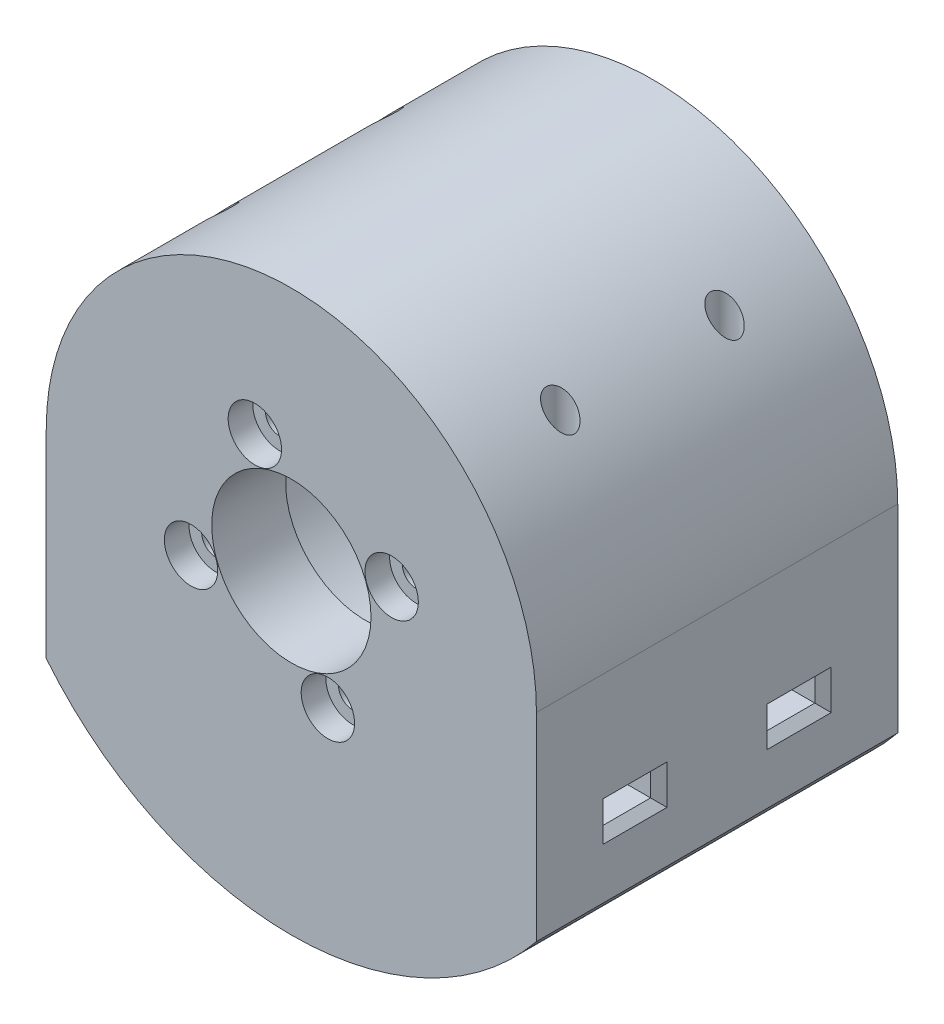
from build123d import *
from build123d.topology import SkipClean

# Parameters (mm, degrees)
BOSS_EXTRUDE1_DEPTH            = 44
CUT_EXTRUDE1_DEPTH             = 35
CUT_EXTRUDE2_REACH             = 67.586
SKETCH2_R                      = 9.7
CBORE_FOR_M3_SHCS1_D           = 3.4
CBORE_FOR_M3_SHCS1_CBORE_D     = 6.5
CBORE_FOR_M3_SHCS1_CBORE_DEPTH = 3
CUT_EXTRUDE3_REACH             = 82.169
SKETCH6_R                      = 1.7
CUT_EXTRUDE4_DEPTH             = 2.8
CHAMFER1_SIZE                  = 1
SPLIT1_SURFACE_1_BACK          = 92.883
SPLIT1_SURFACE_1_DEPTH         = 185.766
SPLIT1_SURFACE_2_BACK          = 92.883
SPLIT1_SURFACE_2_DEPTH         = 185.766
BOSS_EXTRUDE2_START            = -44
BOSS_EXTRUDE2_DEPTH            = 44
SKETCH10_R                     = 1.7
CUT_EXTRUDE5_DEPTH             = 65.916094004
CUT_EXTRUDE6_DEPTH             = 73.576735423
BOSS_EXTRUDE3_DEPTH            = 44


with BuildPart() as part:
    # Sketch1 → Boss-Extrude1 (new body)
    with BuildSketch(Plane.XY):
        with BuildLine():
            Line((-9.452299133, -24.156520859), (-29.85, -24.156520859))
            ThreePointArc((-29.85, -24.156520859), (0, -38.4), (29.85, -24.156520859))
            Line((29.85, -24.156520859), (9.452299133, -24.156520859))
            ThreePointArc((9.452299133, -24.156520859), (0, -27.2), (-9.452299133, -24.156520859))
        make_face()
        with BuildLine():
            Line((29.85, 15.843479141), (-29.85, 15.843479141))
            Line((-29.85, 15.843479141), (-29.85, -24.156520859))
            Line((-29.85, -24.156520859), (-9.452299133, -24.156520859))
            ThreePointArc((-9.452299133, -24.156520859), (-7.392995132, 3.414701626), (16.2, -11))
            ThreePointArc((16.2, -11), (14.414701626, -18.392995132), (9.452299133, -24.156520859))
            Line((9.452299133, -24.156520859), (29.85, -24.156520859))
            Line((29.85, -24.156520859), (29.85, 15.843479141))
        make_face()
        with BuildLine():
            ThreePointArc((16.2, -11), (-7.392995132, 3.414701626), (-9.452299133, -24.156520859))
            Line((-9.452299133, -24.156520859), (9.452299133, -24.156520859))
            ThreePointArc((9.452299133, -24.156520859), (14.414701626, -18.392995132), (16.2, -11))
        make_face()
        with BuildLine():
            Line((9.452299133, -24.156520859), (-9.452299133, -24.156520859))
            ThreePointArc((-9.452299133, -24.156520859), (0, -27.2), (9.452299133, -24.156520859))
        make_face()
    extrude(amount=BOSS_EXTRUDE1_DEPTH)

    # Sketch1<3> → Cut-Extrude1 (cut)
    with BuildSketch(Plane.XY):
        with BuildLine():
            ThreePointArc((16.2, -11), (-7.392995132, 3.414701626), (-9.452299133, -24.156520859))
            Line((-9.452299133, -24.156520859), (9.452299133, -24.156520859))
            ThreePointArc((9.452299133, -24.156520859), (14.414701626, -18.392995132), (16.2, -11))
        make_face()
        with BuildLine():
            Line((9.452299133, -24.156520859), (-9.452299133, -24.156520859))
            ThreePointArc((-9.452299133, -24.156520859), (0, -27.2), (9.452299133, -24.156520859))
        make_face()
    extrude(amount=CUT_EXTRUDE1_DEPTH, mode=Mode.SUBTRACT)

    # Sketch2 → Cut-Extrude2 (cut, up to next)
    with BuildSketch(Plane.XY.offset(44), mode=Mode.PRIVATE) as cut_extrude2_sk1:
        with Locations((0, -11)):
            Circle(SKETCH2_R)
    cut_extrude2_tool1 = extrude(cut_extrude2_sk1.sketch, amount=-CUT_EXTRUDE2_REACH, mode=Mode.PRIVATE) & part.part
    add(cut_extrude2_tool1.solids().sort_by_distance((0, -11, 44))[0], mode=Mode.SUBTRACT)

    # CBORE for M3 SHCS1 (through all)
    with Locations(Plane.XY.offset(44)):
        with Locations((-12.21600407, -15.446261863), (12.21600407, -6.553738137), (4.446261863, -23.21600407), (-4.446261863, 1.21600407)):
            CounterBoreHole(CBORE_FOR_M3_SHCS1_D / 2, CBORE_FOR_M3_SHCS1_CBORE_D / 2, CBORE_FOR_M3_SHCS1_CBORE_DEPTH)

    # Sketch6 → Cut-Extrude3 (cut, up to next)
    with BuildSketch(Plane(origin=(0, -44.156520859, 0), x_dir=(-1, 0, 0), z_dir=(0, -1, 0)), mode=Mode.PRIVATE) as cut_extrude3_sk1:
        with Locations(Location((20.75, -12, 0), (0, 0, 180))):
            Circle(SKETCH6_R)
    cut_extrude3_tool1 = extrude(cut_extrude3_sk1.sketch, amount=-CUT_EXTRUDE3_REACH, mode=Mode.PRIVATE) & part.part
    # Sketch6 → Cut-Extrude3 (cut, up to next)
    with BuildSketch(Plane(origin=(0, -44.156520859, 0), x_dir=(-1, 0, 0), z_dir=(0, -1, 0)), mode=Mode.PRIVATE) as cut_extrude3_sk2:
        with Locations(Location((-20.75, -12, 0), (0, 0, 180))):
            Circle(SKETCH6_R)
    cut_extrude3_tool2 = extrude(cut_extrude3_sk2.sketch, amount=-CUT_EXTRUDE3_REACH, mode=Mode.PRIVATE) & part.part
    # Sketch6 → Cut-Extrude3 (cut, up to next)
    with BuildSketch(Plane(origin=(0, -44.156520859, 0), x_dir=(-1, 0, 0), z_dir=(0, -1, 0)), mode=Mode.PRIVATE) as cut_extrude3_sk3:
        with Locations(Location((20.75, -32, 0), (0, 0, 180))):
            Circle(SKETCH6_R)
    cut_extrude3_tool3 = extrude(cut_extrude3_sk3.sketch, amount=-CUT_EXTRUDE3_REACH, mode=Mode.PRIVATE) & part.part
    # Sketch6 → Cut-Extrude3 (cut, up to next)
    with BuildSketch(Plane(origin=(0, -44.156520859, 0), x_dir=(-1, 0, 0), z_dir=(0, -1, 0)), mode=Mode.PRIVATE) as cut_extrude3_sk4:
        with Locations(Location((-20.75, -32, 0), (0, 0, 180))):
            Circle(SKETCH6_R)
    cut_extrude3_tool4 = extrude(cut_extrude3_sk4.sketch, amount=-CUT_EXTRUDE3_REACH, mode=Mode.PRIVATE) & part.part
    add(cut_extrude3_tool1.solids().sort_by_distance((-20.75, -44.156521, 12))[0], mode=Mode.SUBTRACT)
    add(cut_extrude3_tool2.solids().sort_by_distance((20.75, -44.156521, 12))[0], mode=Mode.SUBTRACT)
    add(cut_extrude3_tool3.solids().sort_by_distance((-20.75, -44.156521, 32))[0], mode=Mode.SUBTRACT)
    add(cut_extrude3_tool4.solids().sort_by_distance((20.75, -44.156521, 32))[0], mode=Mode.SUBTRACT)

    # Sketch7 → Cut-Extrude4 (cut)
    with BuildSketch(Plane(origin=(0, -14.156520859, 0), x_dir=(1, 0, 0), z_dir=(0, 1, 0))):
        Polygon((-29.85, -14.9), (-29.85, -9.1), (-22.424315781, -9.1), (-24.098631561, -12), (-22.424315781, -14.9), align=None)
        Polygon((-24.098631561, -12), (-22.424315781, -14.9), (-22.424315781, -9.1), align=None)
        Polygon((-22.424315781, -14.9), (-22.424315781, -9.1), (-19.075684219, -9.1), (-17.401368439, -12), (-19.075684219, -14.9), align=None)
        Polygon((-29.85, -34.9), (-29.85, -29.1), (-22.424315781, -29.1), (-24.098631561, -32), (-22.424315781, -34.9), align=None)
        Polygon((-24.098631561, -32), (-22.424315781, -34.9), (-22.424315781, -29.1), align=None)
        Polygon((-22.424315781, -34.9), (-22.424315781, -29.1), (-19.075684219, -29.1), (-17.401368439, -32), (-19.075684219, -34.9), align=None)
        Polygon((22.424315781, -29.1), (22.424315781, -34.9), (19.075684219, -34.9), (17.401368439, -32), (19.075684219, -29.1), align=None)
        Polygon((29.85, -29.1), (29.85, -34.9), (22.424315781, -34.9), (24.098631561, -32), (22.424315781, -29.1), align=None)
        Polygon((24.098631561, -32), (22.424315781, -29.1), (22.424315781, -34.9), align=None)
        Polygon((24.098631561, -12), (22.424315781, -9.1), (29.85, -9.1), (29.85, -14.9), (22.424315781, -14.9), align=None)
        Polygon((22.424315781, -14.9), (24.098631561, -12), (22.424315781, -9.1), align=None)
        Polygon((22.424315781, -9.1), (19.075684219, -9.1), (17.401368439, -12), (19.075684219, -14.9), (22.424315781, -14.9), align=None)
    extrude(amount=-CUT_EXTRUDE4_DEPTH, mode=Mode.SUBTRACT)

    # Chamfer1
    chamfer1_edges = [part.edges().sort_by_distance(p)[0] for p in [
        (29.85, -16.956520859, 32),
        (29.85, -14.156520859, 32),
        (29.85, -15.556520859, 29.1),
        (29.85, -15.556520859, 34.9),
        (-29.85, -16.956520859, 32),
        (-29.85, -14.156520859, 32),
        (-29.85, -15.556520859, 34.9),
        (-29.85, -15.556520859, 29.1),
        (-29.85, -16.956520859, 12),
        (-29.85, -14.156520859, 12),
        (-29.85, -15.556520859, 14.9),
        (-29.85, -15.556520859, 9.1),
        (29.85, -16.956520859, 12),
        (29.85, -14.156520859, 12),
        (29.85, -15.556520859, 9.1),
        (29.85, -15.556520859, 14.9),
    ]]
    chamfer(chamfer1_edges, length=CHAMFER1_SIZE)


with BuildPart() as body_2:
    # Split1: the piece behind the surface
    add(part.part)
    # Split1 surface: a surface, the sketch's curves swept straight by 185.766 mm
    with BuildLine(Plane(origin=(0, 0, 0), x_dir=(-1, 0, 0), z_dir=(0, 0, -1)).offset(-SPLIT1_SURFACE_1_BACK), mode=Mode.PRIVATE) as split1_surface_1_path:
        Line((29.85, -12.156520859), (16.901368439, -12.156520859))
        ThreePointArc((16.901368439, -12.156520859), (0, -27.940891228), (-16.901368439, -12.156520859))
        Line((-16.901368439, -12.156520859), (-29.85, -12.156520859))
    split1_surface_1 = Shell.extrude(split1_surface_1_path.wire(), (0 * SPLIT1_SURFACE_1_DEPTH, 0 * SPLIT1_SURFACE_1_DEPTH, -1 * SPLIT1_SURFACE_1_DEPTH))
    split(bisect_by=split1_surface_1, keep=Keep.BOTTOM)


with BuildPart() as part_1:
    add(part.part)

    # Split1: split by a surface, the side it looks to stays
    # Split1 surface: a surface, the sketch's curves swept straight by 185.766 mm
    with BuildLine(Plane(origin=(0, 0, 0), x_dir=(-1, 0, 0), z_dir=(0, 0, -1)).offset(-SPLIT1_SURFACE_2_BACK), mode=Mode.PRIVATE) as split1_surface_2_path:
        Line((29.85, -12.156520859), (16.901368439, -12.156520859))
        ThreePointArc((16.901368439, -12.156520859), (0, -27.940891228), (-16.901368439, -12.156520859))
        Line((-16.901368439, -12.156520859), (-29.85, -12.156520859))
    split1_surface_2 = Shell.extrude(split1_surface_2_path.wire(), (0 * SPLIT1_SURFACE_2_DEPTH, 0 * SPLIT1_SURFACE_2_DEPTH, -1 * SPLIT1_SURFACE_2_DEPTH))
    split(bisect_by=split1_surface_2, keep=Keep.TOP)


with BuildPart() as part_2:
    # Body-Move/Copy1: moved
    add(part_1.part.moved(Location((0, -11, 0))))


    add(body_2.part)  # Boss-Extrude2 merges body 2
    # Sketch9 → Boss-Extrude2 (add)
    with BuildSketch(Plane(origin=(0, 0, 0), x_dir=(-1, 0, 0), z_dir=(0, 0, -1)).offset(BOSS_EXTRUDE2_START)):
        with BuildLine():
            Line((-16.901368439, -23.156520859), (-29.85, -23.156520859))
            Line((-29.85, -23.156520859), (-29.85, -12.156520859))
            Line((-29.85, -12.156520859), (-16.901368439, -12.156520859))
            ThreePointArc((-16.901368439, -12.156520859), (0, -27.940891228), (16.901368439, -12.156520859))
            Line((16.901368439, -12.156520859), (29.85, -12.156520859))
            Line((29.85, -12.156520859), (29.85, -23.156520859))
            Line((29.85, -23.156520859), (16.901368439, -23.156520859))
            ThreePointArc((16.901368439, -23.156520859), (0, -38.940891228), (-16.901368439, -23.156520859))
        make_face()
    extrude(amount=BOSS_EXTRUDE2_DEPTH)

    # Sketch10 → Cut-Extrude5 (cut, through all)
    with BuildSketch(Plane(origin=(0, -12.156520859, 0), x_dir=(1, 0, 0), z_dir=(0, 1, 0))):
        with Locations(Location((20.75, -32, 0), (0, 0, 270))):
            Circle(SKETCH10_R)
        with Locations(Location((-20.75, -32, 0), (0, 0, 270))):
            Circle(SKETCH10_R)
        with Locations(Location((-20.75, -12, 0), (0, 0, 270))):
            Circle(SKETCH10_R)
        with Locations(Location((20.75, -12, 0), (0, 0, 270))):
            Circle(SKETCH10_R)
    extrude(amount=-CUT_EXTRUDE5_DEPTH, mode=Mode.SUBTRACT)

    # Sketch11 → Cut-Extrude6 (cut, through all)
    with BuildSketch(Plane(origin=(0, 0, 0), x_dir=(-1, 0, 0), z_dir=(0, 0, -1))):
        with BuildLine():
            Line((-29.85, 15.843479141), (-29.85, -11))
            ThreePointArc((-29.85, -11), (-25.305471759, 4.832106589), (-13.055655004, 15.843479141))
            Line((-13.055655004, 15.843479141), (-29.85, 15.843479141))
        make_face()
        with BuildLine():
            Line((29.85, 15.843479141), (13.055655004, 15.843479141))
            ThreePointArc((13.055655004, 15.843479141), (25.305471759, 4.832106589), (29.85, -11))
            Line((29.85, -11), (29.85, 15.843479141))
        make_face()
    extrude(amount=-CUT_EXTRUDE6_DEPTH, mode=Mode.SUBTRACT)

    # Sketch12 → Boss-Extrude3 (add)
    with SkipClean():  # the faces are left unmerged after this step: merging them gives an invalid solid
        with BuildSketch(Plane(origin=(0, 0, 0), x_dir=(-1, 0, 0), z_dir=(0, 0, -1))):
            with BuildLine():
                Line((13.055655004, 15.843479141), (-13.055655004, 15.843479141))
                ThreePointArc((-13.055655004, 15.843479141), (0, 18.85), (13.055655004, 15.843479141))
            make_face()
        extrude(amount=-BOSS_EXTRUDE3_DEPTH)


solid = part_2.part
